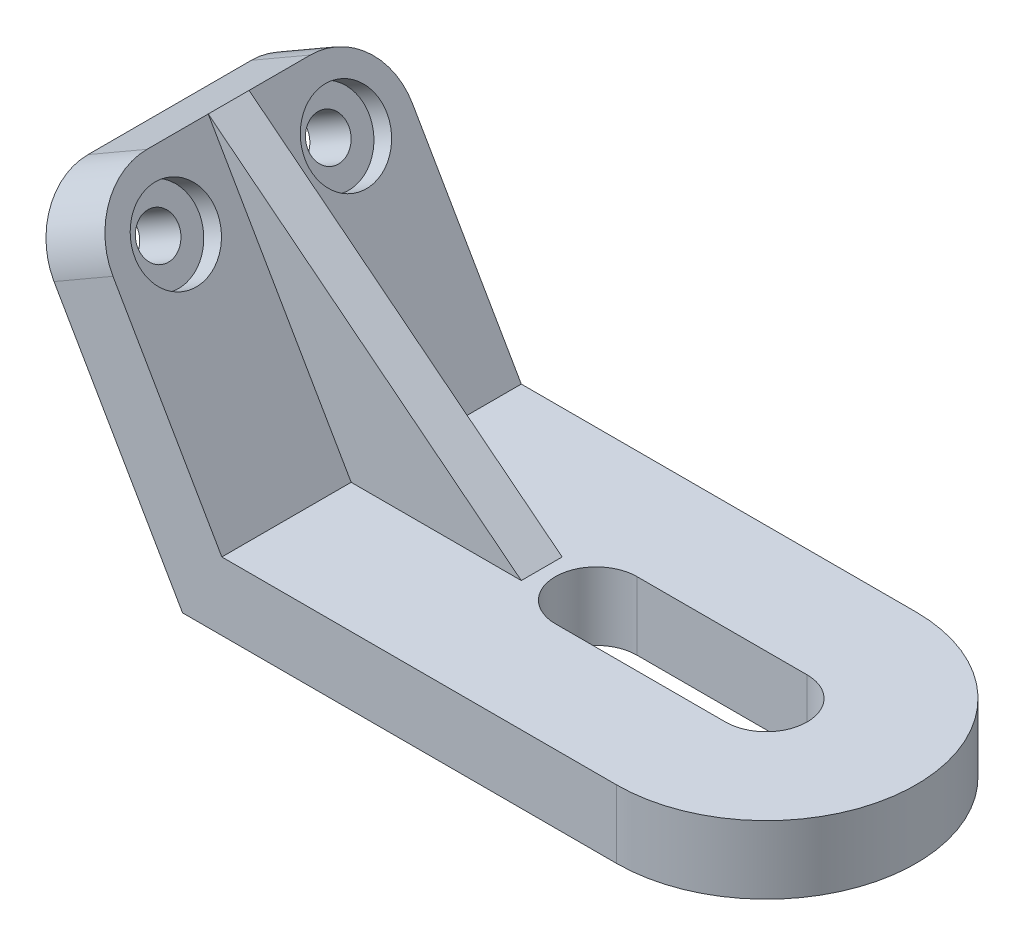
from build123d import *

# Parameters (mm, degrees)
BOSS_EXTRUDE1_DEPTH                     = 22
BOSS_EXTRUDE1_DEPTH_BACK                = 22
BOSS_EXTRUDE3_DEPTH                     = 10
CUT_EXTRUDE2_DEPTH                      = 10
RIB1_REACH                              = 103.581
SKETCH4_WALL_W                          = 263.805794056
SKETCH4_WALL_H                          = 6
CBORE_FOR_M5_HEX_HEAD_BOLT1_D           = 6
CBORE_FOR_M5_HEX_HEAD_BOLT1_DEPTH       = 10
CBORE_FOR_M5_HEX_HEAD_BOLT1_CBORE_D     = 12
CBORE_FOR_M5_HEX_HEAD_BOLT1_CBORE_DEPTH = 3
CBORE_FOR_M5_HEX_HEAD_BOLT1_TIP         = 1.732050808
FILLET1_R                               = 10


with BuildPart() as part:
    # Sketch1 → Boss-Extrude1 (new, two sides: drawn at the far end of the back side and taken through both)
    with BuildSketch(Plane.XY.offset(-BOSS_EXTRUDE1_DEPTH_BACK)):
        Polygon((0, 0), (-63.773502692, 0), (-87.660254038, 41.373066959), (-79, 46.373066959), (-58, 10), (0, 10), align=None)
    extrude(amount=BOSS_EXTRUDE1_DEPTH + BOSS_EXTRUDE1_DEPTH_BACK)

    # Sketch3 → Boss-Extrude3 (add)
    with BuildSketch(Plane(origin=(0, 10, 0), x_dir=(1, 0, 0), z_dir=(0, 1, 0))):
        with BuildLine():
            Line((0, -6), (0, -22))
            ThreePointArc((0, -22), (22, 0), (0, 22))
            Line((0, 22), (0, 6))
            ThreePointArc((0, 6), (6, 0), (0, -6))
        make_face()
    extrude(amount=-BOSS_EXTRUDE3_DEPTH)

    # Sketch3<3> → Cut-Extrude2 (cut)
    with BuildSketch(Plane(origin=(0, 10, 0), x_dir=(1, 0, 0), z_dir=(0, 1, 0))):
        with BuildLine():
            ThreePointArc((0, -6), (6, 0), (0, 6))
            Line((0, 6), (-25, 6))
            ThreePointArc((-25, 6), (-31, 0), (-25, -6))
            Line((-25, -6), (0, -6))
        make_face()
    extrude(amount=-CUT_EXTRUDE2_DEPTH, mode=Mode.SUBTRACT)

    # Sketch4 wall → Rib1 (add, up to next)
    with BuildSketch(Plane(origin=(-56, 28.186533479, 0), x_dir=(0.784407511397, -0.620245802939, 0), z_dir=(0.620245802939, 0.784407511397, 0)), mode=Mode.PRIVATE) as rib1_sk1:
        Rectangle(SKETCH4_WALL_W, SKETCH4_WALL_H)
    rib1_tool1 = extrude(rib1_sk1.sketch, amount=-RIB1_REACH, mode=Mode.PRIVATE) - part.part
    add(rib1_tool1.solids().sort_by_distance((-56, 28.186533479, 0))[0])

    # CBORE for M5 Hex Head Bolt1
    with Locations(Plane(origin=(-39.169872981, -22.61473671, 0), x_dir=(0, 0, -1), z_dir=(0.8660254037844395, 0.49999999999999856, 0))):
        with Locations((-12.5, 70.186913626), (12.5, 70.186913626)):
            CounterBoreHole(CBORE_FOR_M5_HEX_HEAD_BOLT1_D / 2, CBORE_FOR_M5_HEX_HEAD_BOLT1_CBORE_D / 2, CBORE_FOR_M5_HEX_HEAD_BOLT1_CBORE_DEPTH, depth=CBORE_FOR_M5_HEX_HEAD_BOLT1_DEPTH)
            with Locations((0, 0, -(CBORE_FOR_M5_HEX_HEAD_BOLT1_DEPTH + CBORE_FOR_M5_HEX_HEAD_BOLT1_TIP / 2))):  # 120° drill point
                Cone(0, CBORE_FOR_M5_HEX_HEAD_BOLT1_D / 2, CBORE_FOR_M5_HEX_HEAD_BOLT1_TIP, mode=Mode.SUBTRACT)

    # Fillet1
    fillet1_edges = [part.edges().sort_by_distance(p)[0] for p in [
        (-83.330127019, 43.873066959, -22),
        (-83.330127019, 43.873066959, 22),
    ]]
    fillet(fillet1_edges, radius=FILLET1_R)


solid = part.part
